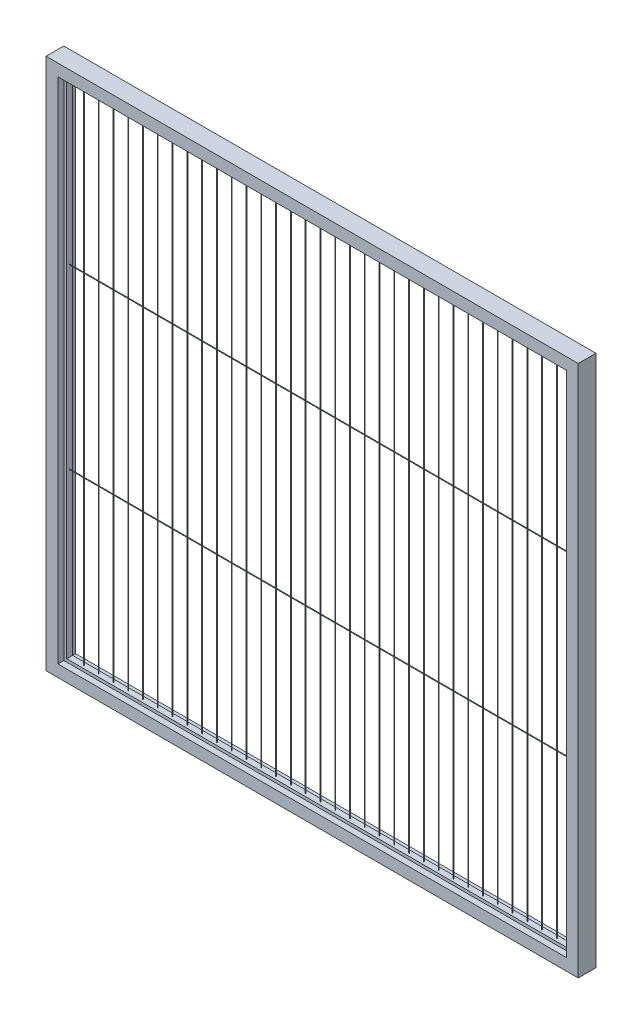
from build123d import *

# Parameters (mm, degrees)
EXTRUDE_1_DEPTH        = 900
EXTRUDE_1_2_DEPTH      = 900
EXTRUDE_2_DEPTH        = 1720
EXTRUDE_2_2_DEPTH      = 1720
SKETCH_4_W             = 50
SKETCH_4_H             = 60
CUT_EXTRUDE_1_DEPTH    = 10
SKETCH_5_W             = 50
SKETCH_5_H             = 60
CUT_EXTRUDE_2_DEPTH    = 10
SKETCH_6_R             = 1
EXTRUDE_3_DEPTH        = 1700
PATTERN_LINEAR_1_COUNT = 2
PATTERN_LINEAR_1_PITCH = 600
SKETCH_8_R             = 1
EXTRUDE_4_DEPTH        = 1700
PATTERN_LINEAR_2_COUNT = 48
PATTERN_LINEAR_2_PITCH = 50


with BuildPart() as part:
    # 草图1 → 凸台-拉伸1 (new, symmetric)
    with BuildSketch(Plane(origin=(0, 0, 0), x_dir=(0, 0, -1), z_dir=(1, 0, 0))):
        Polygon((30, 0), (-30, 0), (-30, 40), (-10, 40), (-10, 50), (10, 50), (10, 40), (30, 40), align=None)
    extrude(amount=EXTRUDE_1_DEPTH, both=True)

    # 草图5 → 切除-拉伸2 (cut)
    with BuildSketch(Plane(origin=(0, 40, 0), x_dir=(1, 0, 0), z_dir=(0, 1, 0))):
        with Locations((-875, 0)):
            Rectangle(SKETCH_5_W, SKETCH_5_H)
        with Locations((875, 0)):
            Rectangle(SKETCH_5_W, SKETCH_5_H)
    extrude(amount=CUT_EXTRUDE_2_DEPTH, mode=Mode.SUBTRACT)


with BuildPart() as body_2:
    # 草图1 → Extrude 1 2 (new, symmetric)
    with BuildSketch(Plane(origin=(0, 0, 0), x_dir=(0, 0, -1), z_dir=(1, 0, 0))):
        Polygon((30, 1800), (30, 1760), (10, 1760), (10, 1750), (-10, 1750), (-10, 1760), (-30, 1760), (-30, 1800), align=None)
    extrude(amount=EXTRUDE_1_2_DEPTH, both=True)

    # 草图4 → 切除-拉伸1 (cut)
    with BuildSketch(Plane.XZ.offset(-1760)):
        with Locations((-875, 0)):
            Rectangle(SKETCH_4_W, SKETCH_4_H)
        with Locations((875, 0)):
            Rectangle(SKETCH_4_W, SKETCH_4_H)
    extrude(amount=CUT_EXTRUDE_1_DEPTH, mode=Mode.SUBTRACT)



with BuildPart() as body_3:
    # 草图3 → 凸台-拉伸2 (new body)
    with BuildSketch(Plane.XZ.offset(-1760)):
        Polygon((-900, -30), (-900, 30), (-860, 30), (-860, 10), (-850, 10), (-850, -10), (-860, -10), (-860, -30), align=None)
    extrude(amount=EXTRUDE_2_DEPTH)



with BuildPart() as body_4:
    # 草图3 → Extrude 2 2 (new body)
    with BuildSketch(Plane.XZ.offset(-1760)):
        Polygon((860, -30), (900, -30), (900, 30), (860, 30), (860, 10), (850, 10), (850, -10), (860, -10), align=None)
    extrude(amount=EXTRUDE_2_2_DEPTH)


with BuildPart() as body_3_1:
    add(body_3.part)

    add(body_4.part)  # 凸台-拉伸3 merges body 4
    # 草图6 → 凸台-拉伸3 (add)
    with BuildSketch(Plane.ZY.offset(-850)):
        with Locations(Location((0, 1200, 0), (0, 0, 180))):
            Circle(SKETCH_6_R)
    extrude_3 = extrude(amount=EXTRUDE_3_DEPTH)

    # 阵列(线性)1: 凸台-拉伸3 ×2
    with Locations(*[(0, -i * PATTERN_LINEAR_1_PITCH, 0) for i in range(1, PATTERN_LINEAR_1_COUNT)]):
        add(extrude_3)


with BuildPart() as body_2_1:
    add(body_2.part)

    add(body_3_1.part)  # 凸台-拉伸4 merges body 3
    # 草图8 → 凸台-拉伸4 (add)
    with BuildSketch(Plane.XZ.offset(-1750)):
        with Locations(Location((-802, 0, 0), (0, 0, 90))):
            Circle(SKETCH_8_R)
    extrude_4 = extrude(amount=EXTRUDE_4_DEPTH)


with BuildPart() as part_1:
    add(part.part)

    add(body_2_1.part)  # 阵列(线性)2 merges body 2
    # 阵列(线性)2: 凸台-拉伸4 ×48, 13 skipped
    with Locations(*[(i * PATTERN_LINEAR_2_PITCH, 0, 0) for i in range(1, PATTERN_LINEAR_2_COUNT) if i not in (35, 36, 37, 38, 39, 40, 41, 42, 43, 44, 45, 46, 47)]):
        add(extrude_4)


solid = part_1.part
